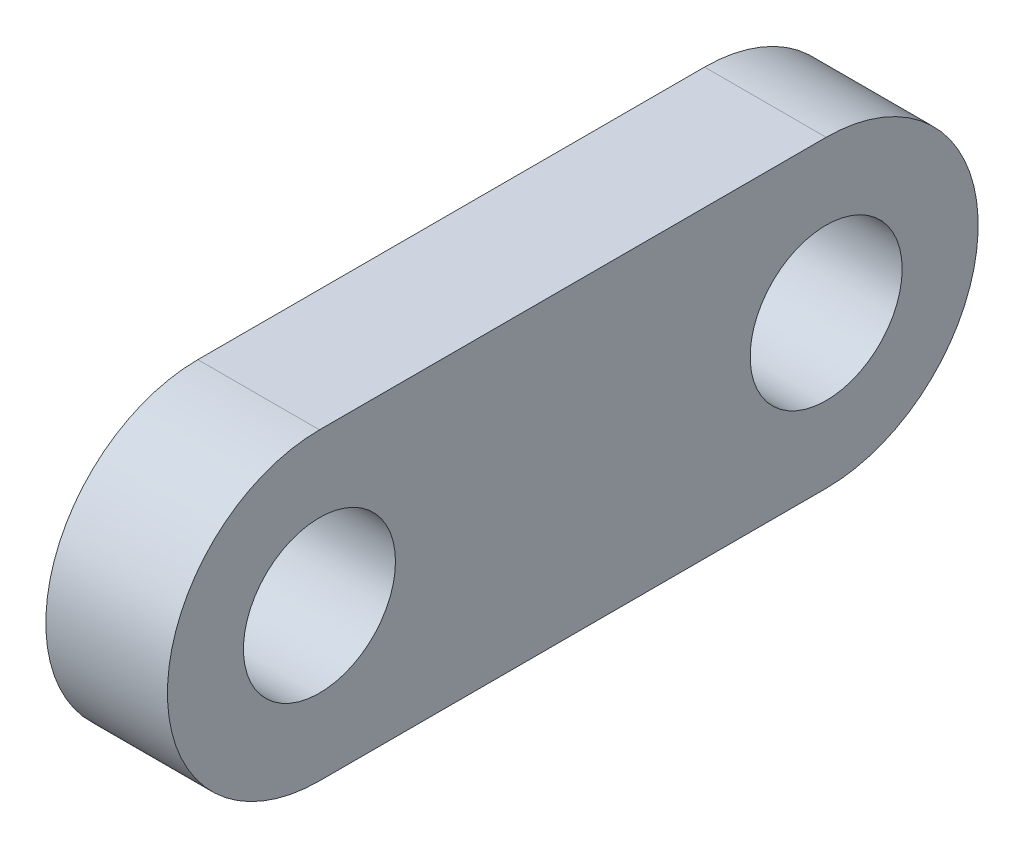
from build123d import *

# Parameters (mm, degrees)
CROQUIS1_R              = 7.5
SALIENTE_EXTRUIR1_DEPTH = 12


with BuildPart() as part:
    # Croquis1 → Saliente-Extruir1 (new body)
    with BuildSketch(Plane(origin=(0, 0, 0), x_dir=(0, 0, -1), z_dir=(1, 0, 0))):
        with BuildLine():
            Line((0, 15), (50, 15))
            ThreePointArc((50, 15), (65, 0), (50, -15))
            Line((50, -15), (0, -15))
            ThreePointArc((0, -15), (-15, 0), (0, 15))
        make_face()
        Circle(CROQUIS1_R, mode=Mode.SUBTRACT)
        with Locations((50, 0)):
            Circle(CROQUIS1_R, mode=Mode.SUBTRACT)
    extrude(amount=SALIENTE_EXTRUIR1_DEPTH)


solid = part.part
